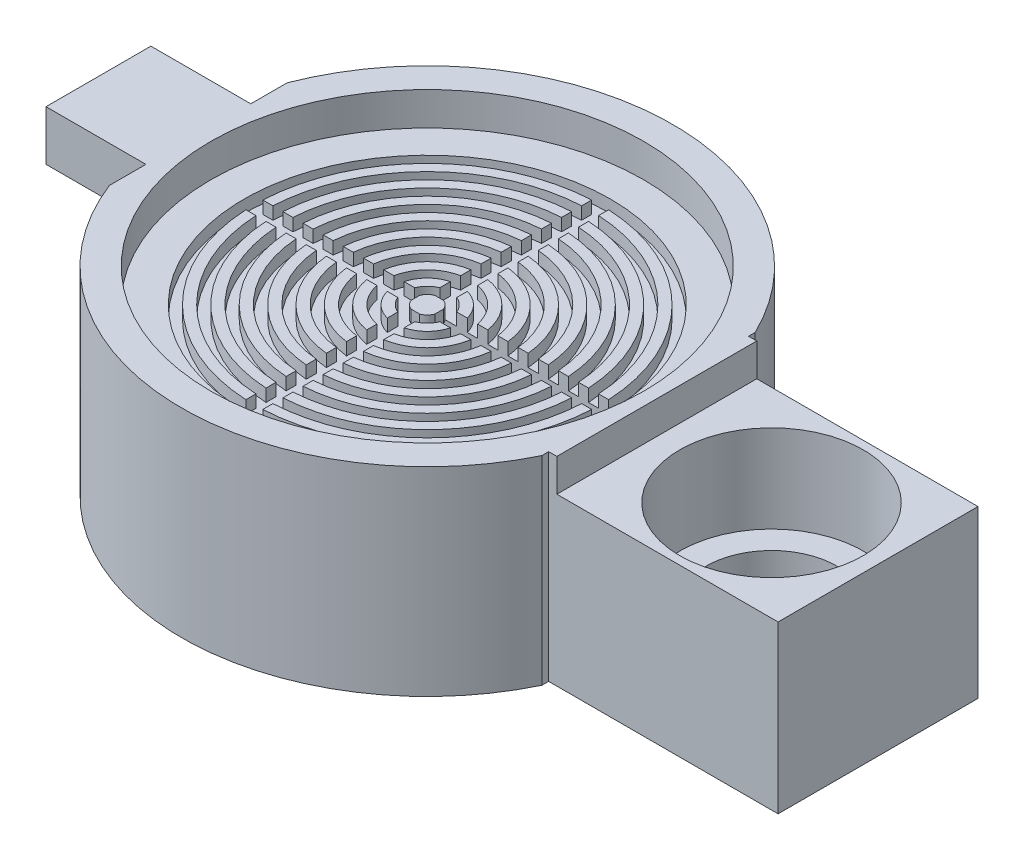
from build123d import *

# Parameters (mm, degrees)
CIRCULAR_MEMBRANE_HOLDER_DEPTH       = 5.842
CIRCULAR_MEMBRANE_HOLDER_DEPTH_BACK  = 6.3
SKETCH1_R                            = 14.986
SKETCH11_R                           = 10.922
SKETCH11_R_2                         = 8.89
STABILIZER_UNDERMOUNT_DEPTH          = 1.016
SKETCH2_R                            = 13.208
MEMBRANE_WELL_DEPTH                  = 2.032
SKETCH3_R                            = 11.176
PERMEATE_COLLECTION_WELL_DEPTH       = 0.762
SKETCH4_R                            = 10.56386
SKETCH4_R_2                          = 9.95172
SKETCH4_R_3                          = 9.33958
SKETCH4_R_4                          = 8.72744
SKETCH4_R_5                          = 8.1153
SKETCH4_R_6                          = 7.50316
SKETCH4_R_7                          = 6.89102
SKETCH4_R_8                          = 6.27888
SKETCH4_R_9                          = 5.66674
SKETCH4_R_10                         = 5.0546
SKETCH4_R_11                         = 4.44246
SKETCH4_R_12                         = 3.83032
SKETCH4_R_13                         = 3.21818
SKETCH4_R_14                         = 2.60604
SKETCH4_R_15                         = 1.9939
SKETCH4_R_16                         = 1.38176
SKETCH4_R_17                         = 0.76962
MEMBRANE_SUPPORT_PERMEATE_WELL_DEPTH = 0.762
SKETCH5_W                            = 1.03124
SKETCH5_H                            = 9.968654276
PERMEATE_WELL_BRANCHES_DEPTH         = 0.762
CIRPATTERN1_COUNT                    = 4
WELL_TO_OUTLET_DEPTH                 = 1.016
SKETCH7_W                            = 3.956721546
SKETCH7_H                            = 50.8
SKETCH7_W_2                          = 4.337890601
FLATTEN_ROUND_EDGES_DEPTH            = 25.425162354
SKETCH8_W                            = 6.4
SKETCH8_H                            = 3.048
STABILIZER_NON_PERMEATE_DEPTH        = 6.096
SKETCH22_W                           = 12.2
SKETCH22_H                           = 12.142
STABILIZER_PERMEATE_SIDE_DEPTH       = 14
CUT_EXTRUDE8_DEPTH                   = 0.762
SKETCH41_W                           = 10
SKETCH41_H                           = 2.7
PROBE_SLIT_CUT_OUT_DEPTH             = 9.5
PROBE_SLIT_INSERT_DEPTH              = 11
SKETCH48_R                           = 5.6
STIR_BAR_AREA_DEPTH                  = 7.35
SKETCH42_R                           = 4
PROBE_AREA_DEPTH                     = 9.442
SKETCH47_R                           = 0.6
SKETCH50_W                           = 13.5
SKETCH50_H                           = 12.2
CUT_EXTRUDE9_DEPTH                   = 2


with BuildPart() as part:
    # Sketch1 → Circular Membrane Holder (new, two sides: drawn at the far end of the back side and taken through both)
    with BuildSketch(Plane(origin=(0, 0, 0), x_dir=(1, 0, 0), z_dir=(0, 1, 0)).offset(-CIRCULAR_MEMBRANE_HOLDER_DEPTH_BACK)):
        with Locations(Location((0, 0, 0), (0, 0, 270))):
            Circle(SKETCH1_R)
    extrude(amount=CIRCULAR_MEMBRANE_HOLDER_DEPTH + CIRCULAR_MEMBRANE_HOLDER_DEPTH_BACK)

    # Sketch11 → Stabilizer - Undermount (add)
    with BuildSketch(Plane.XZ.offset(6.3)):
        with Locations(Location((0, 0, 0), (0, 0, 90))):
            Circle(SKETCH11_R)
        with Locations(Location((0, 0, 0), (0, 0, 270))):
            Circle(SKETCH11_R_2, mode=Mode.SUBTRACT)
    extrude(amount=STABILIZER_UNDERMOUNT_DEPTH)

    # Sketch2 → Membrane Well (cut)
    with BuildSketch(Plane(origin=(0, 5.842, 0), x_dir=(1, 0, 0), z_dir=(0, 1, 0))):
        with Locations(Location((0, 0, 0), (0, 0, 270))):
            Circle(SKETCH2_R)
    extrude(amount=-MEMBRANE_WELL_DEPTH, mode=Mode.SUBTRACT)

    # Sketch3 → Permeate Collection Well (cut)
    with BuildSketch(Plane(origin=(0, 3.81, 0), x_dir=(1, 0, 0), z_dir=(0, 1, 0))):
        with Locations(Location((0, 0, 0), (0, 0, 270))):
            Circle(SKETCH3_R)
    extrude(amount=-PERMEATE_COLLECTION_WELL_DEPTH, mode=Mode.SUBTRACT)

    # Sketch4 → Membrane Support - Permeate Well (add)
    # profile 1 of 9: a face of its own
    with BuildSketch(Plane(origin=(0, 3.048, 0), x_dir=(1, 0, 0), z_dir=(0, 1, 0))):
        with Locations(Location((0, 0, 0), (0, 0, 270))):
            Circle(SKETCH4_R)
        with Locations(Location((0, 0, 0), (0, 0, 270))):
            Circle(SKETCH4_R_2, mode=Mode.SUBTRACT)
    # profile 2 of 9: a face of its own
    with BuildSketch(Plane(origin=(0, 3.048, 0), x_dir=(1, 0, 0), z_dir=(0, 1, 0))):
        with Locations(Location((0, 0, 0), (0, 0, 270))):
            Circle(SKETCH4_R_3)
        with Locations(Location((0, 0, 0), (0, 0, 270))):
            Circle(SKETCH4_R_4, mode=Mode.SUBTRACT)
    # profile 3 of 9: a face of its own
    with BuildSketch(Plane(origin=(0, 3.048, 0), x_dir=(1, 0, 0), z_dir=(0, 1, 0))):
        with Locations(Location((0, 0, 0), (0, 0, 270))):
            Circle(SKETCH4_R_5)
        with Locations(Location((0, 0, 0), (0, 0, 270))):
            Circle(SKETCH4_R_6, mode=Mode.SUBTRACT)
    # profile 4 of 9: a face of its own
    with BuildSketch(Plane(origin=(0, 3.048, 0), x_dir=(1, 0, 0), z_dir=(0, 1, 0))):
        with Locations(Location((0, 0, 0), (0, 0, 270))):
            Circle(SKETCH4_R_7)
        with Locations(Location((0, 0, 0), (0, 0, 270))):
            Circle(SKETCH4_R_8, mode=Mode.SUBTRACT)
    # profile 5 of 9: a face of its own
    with BuildSketch(Plane(origin=(0, 3.048, 0), x_dir=(1, 0, 0), z_dir=(0, 1, 0))):
        with Locations(Location((0, 0, 0), (0, 0, 270))):
            Circle(SKETCH4_R_9)
        with Locations(Location((0, 0, 0), (0, 0, 270))):
            Circle(SKETCH4_R_10, mode=Mode.SUBTRACT)
    # profile 6 of 9: a face of its own
    with BuildSketch(Plane(origin=(0, 3.048, 0), x_dir=(1, 0, 0), z_dir=(0, 1, 0))):
        with Locations(Location((0, 0, 0), (0, 0, 270))):
            Circle(SKETCH4_R_11)
        with Locations(Location((0, 0, 0), (0, 0, 270))):
            Circle(SKETCH4_R_12, mode=Mode.SUBTRACT)
    # profile 7 of 9: a face of its own
    with BuildSketch(Plane(origin=(0, 3.048, 0), x_dir=(1, 0, 0), z_dir=(0, 1, 0))):
        with Locations(Location((0, 0, 0), (0, 0, 270))):
            Circle(SKETCH4_R_13)
        with Locations(Location((0, 0, 0), (0, 0, 270))):
            Circle(SKETCH4_R_14, mode=Mode.SUBTRACT)
    # profile 8 of 9: a face of its own
    with BuildSketch(Plane(origin=(0, 3.048, 0), x_dir=(1, 0, 0), z_dir=(0, 1, 0))):
        with Locations(Location((0, 0, 0), (0, 0, 270))):
            Circle(SKETCH4_R_15)
        with Locations(Location((0, 0, 0), (0, 0, 270))):
            Circle(SKETCH4_R_16, mode=Mode.SUBTRACT)
    # profile 9 of 9: a face of its own
    with BuildSketch(Plane(origin=(0, 3.048, 0), x_dir=(1, 0, 0), z_dir=(0, 1, 0))):
        with Locations(Location((0, 0, 0), (0, 0, 270))):
            Circle(SKETCH4_R_17)
    extrude(amount=MEMBRANE_SUPPORT_PERMEATE_WELL_DEPTH)

    # Sketch5 → Permeate Well Branches (cut)
    with BuildSketch(Plane(origin=(0, 3.81, 0), x_dir=(1, 0, 0), z_dir=(0, 1, 0))):
        with Locations((0, 5.708404548)):
            Rectangle(SKETCH5_W, SKETCH5_H)
    permeate_well_branches = extrude(amount=-PERMEATE_WELL_BRANCHES_DEPTH, mode=Mode.SUBTRACT)

    # CirPattern1: Permeate Well Branches ×4 about axis
    cirpattern1_axis = Axis((0, 0, 0), (0, 1, 0))
    for i in range(1, CIRPATTERN1_COUNT):
        add(permeate_well_branches.rotate(cirpattern1_axis, i * 360 / CIRPATTERN1_COUNT), mode=Mode.SUBTRACT)

    # Sketch6 → Well to Outlet (cut)
    with BuildSketch(Plane(origin=(0, 3.048, 0), x_dir=(1, 0, 0), z_dir=(0, 1, 0))):
        with BuildLine():
            Line((0, 0.51562), (0.51562, 0.51562))
            Line((0.51562, 0.51562), (11.164099248, 0.51562))
            Line((11.164099248, 0.51562), (11.164099248, -0.51562))
            Line((11.164099248, -0.51562), (0.51562, -0.51562))
            Line((0.51562, -0.51562), (0, -0.51562))
            ThreePointArc((0, -0.51562), (0.51562, 0), (0, 0.51562))
        make_face()
    extrude(amount=-WELL_TO_OUTLET_DEPTH, mode=Mode.SUBTRACT)

    # Sketch7 → Flatten Round Edges (cut, through all)
    with BuildSketch(Plane.XZ.offset(6.3)):
        with Locations((-15.948360773, 0)):
            Rectangle(SKETCH7_W, SKETCH7_H)
        with Locations((15.668945301, 0)):
            Rectangle(SKETCH7_W_2, SKETCH7_H)
    extrude(amount=-FLATTEN_ROUND_EDGES_DEPTH, mode=Mode.SUBTRACT)

    # Sketch8 → Stabilizer - Non Permeate (add)
    with BuildSketch(Plane.ZY.offset(13.97)):
        with Locations((0, 4.318)):
            Rectangle(SKETCH8_W, SKETCH8_H)
    extrude(amount=STABILIZER_NON_PERMEATE_DEPTH)

    # Sketch22 → Stabilizer - Permeate Side (add)
    with BuildSketch(Plane(origin=(13.5, 0, 0), x_dir=(0, 0, -1), z_dir=(1, 0, 0))):
        with Locations((0.006165998, -0.229)):
            Rectangle(SKETCH22_W, SKETCH22_H)
    extrude(amount=STABILIZER_PERMEATE_SIDE_DEPTH)

    # Sketch14 → Cut-Extrude8 (cut)
    with BuildSketch(Plane(origin=(0, 2.032, 0), x_dir=(1, 0, 0), z_dir=(0, 1, 0))):
        with BuildLine():
            Line((11.164099248, -0.51562), (9.512822181, -0.51562))
            ThreePointArc((9.512822181, -0.51562), (8.997202181, 0), (9.512822181, 0.51562))
            Line((9.512822181, 0.51562), (11.164099248, 0.51562))
            Line((11.164099248, 0.51562), (11.164099248, -0.51562))
        make_face()
    extrude(amount=-CUT_EXTRUDE8_DEPTH, mode=Mode.SUBTRACT)

    # Sketch41 → Probe Slit Cut Out (cut)
    with BuildSketch(Plane(origin=(0, 0, -6.106165998), x_dir=(-1, 0, 0), z_dir=(0, 0, -1))):
        with Locations((-21, -4.95)):
            Rectangle(SKETCH41_W, SKETCH41_H)
    extrude(amount=-PROBE_SLIT_CUT_OUT_DEPTH, mode=Mode.SUBTRACT)

    # Sketch34 → Probe Slit Insert (add)
    with BuildSketch(Plane(origin=(0, 0, -6.106165998), x_dir=(-1, 0, 0), z_dir=(0, 0, -1))):
        Polygon((-26, -6.3), (-26, -3.6), (-24.9, -3.6), (-24.9, -4.5), (-17.1, -4.5), (-17.1, -3.6), (-16, -3.6), (-16, -6.3), align=None)
    extrude(amount=-PROBE_SLIT_INSERT_DEPTH)

    # Sketch48 → Stir Bar Area (cut)
    with BuildSketch(Plane(origin=(0, 5.842, 0), x_dir=(1, 0, 0), z_dir=(0, 1, 0))):
        with Locations(Location((21, 0.006165998, 0), (0, 0, 270))):
            Circle(SKETCH48_R)
    extrude(amount=-STIR_BAR_AREA_DEPTH, mode=Mode.SUBTRACT)

    # Sketch42 → Probe Area (cut)
    with BuildSketch(Plane(origin=(0, 5.842, 0), x_dir=(1, 0, 0), z_dir=(0, 1, 0))):
        with Locations(Location((21, 0.006165998, 0), (0, 0, 270))):
            Circle(SKETCH42_R)
    extrude(amount=-PROBE_AREA_DEPTH, mode=Mode.SUBTRACT)

    # Cut-Sweep1: sweep along a path in Sketch18
    with BuildLine(Plane.XY) as cut_sweep1_path:
        Line((10.656099248, 1.7272), (13.656099248, -2.6728))
        Line((13.656099248, -2.6728), (23.656099248, -2.6728))
    # Sketch47 → Cut-Sweep1 (sweep, cut)
    with BuildSketch(Plane(origin=(21, 0, 0), x_dir=(0, 0, -1), z_dir=(1, 0, 0))):
        with Locations((0, -2.6728)):
            Circle(SKETCH47_R)
    sweep(path=cut_sweep1_path.line, transition=Transition.RIGHT, mode=Mode.SUBTRACT)

    # Sketch50 → Cut-Extrude9 (cut)
    with BuildSketch(Plane(origin=(0, 5.842, 0), x_dir=(1, 0, 0), z_dir=(0, 1, 0))):
        with Locations((20.75, 0.006165998)):
            Rectangle(SKETCH50_W, SKETCH50_H)
    extrude(amount=-CUT_EXTRUDE9_DEPTH, mode=Mode.SUBTRACT)


solid = part.part
